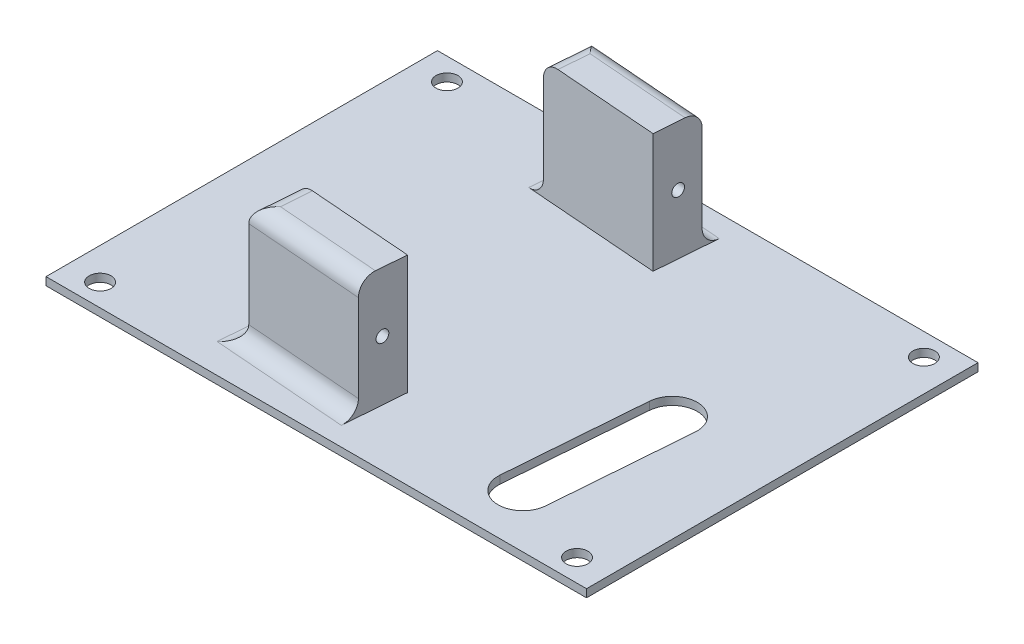
from build123d import *

# Parameters (mm, degrees)
IZIM1_W                     = 54.4
IZIM1_H                     = 39.4
Y_KSEKLIK_EKSTR_ZYON1_DEPTH = 0.8
IZIM2_R                     = 1.1
KES_EKSTR_ZYON1_DEPTH       = 68.174102153
Y_KSEKLIK_EKSTR_ZYON2_DEPTH = 12
KES_EKSTR_ZYON2_DEPTH       = 69.23283667
IZIM4_R                     = 0.6
KES_EKSTR_ZYON3_DEPTH       = 6
RADYUS1_R                   = 1.6


with BuildPart() as part:
    # Çizim1 → Yükseklik-Ekstrüzyon1 (new body)
    with BuildSketch(Plane(origin=(0, 0, 0), x_dir=(1, 0, 0), z_dir=(0, 1, 0))):
        with Locations((27.2, 19.7)):
            Rectangle(IZIM1_W, IZIM1_H)
    extrude(amount=Y_KSEKLIK_EKSTR_ZYON1_DEPTH)

    # Çizim2 → Kes-Ekstrüzyon1 (cut, through all)
    with BuildSketch(Plane(origin=(0, 0.8, 0), x_dir=(1, 0, 0), z_dir=(0, 1, 0))):
        with Locations((3.2, 37.155)):
            Circle(IZIM2_R)
        with Locations((51.2, 37.155)):
            Circle(IZIM2_R)
        with Locations((3.2, 2.245)):
            Circle(IZIM2_R)
        with Locations((51.2, 2.245)):
            Circle(IZIM2_R)
    extrude(amount=-KES_EKSTR_ZYON1_DEPTH, mode=Mode.SUBTRACT)

    # Çizim3 → Yükseklik-Ekstrüzyon2 (add)
    with BuildSketch(Plane(origin=(0, 0.8, 0), x_dir=(1, 0, 0), z_dir=(0, 1, 0))):
        Polygon((16.339737047, 9.008662918), (15.983627663, 4.422467752), (27.947615054, 3.49348675), (28.303724438, 8.079681916), align=None)
        Polygon((30.440380743, 35.596852916), (18.476393352, 36.525833918), (18.120283968, 31.939638752), (30.084271359, 31.01065775), align=None)
    extrude(amount=Y_KSEKLIK_EKSTR_ZYON2_DEPTH)

    # Çizim3<3> → Kes-Ekstrüzyon2 (cut, through all)
    with BuildSketch(Plane(origin=(0, 0.8, 0), x_dir=(1, 0, 0), z_dir=(0, 1, 0))):
        with BuildLine():
            Line((45.128842442, 5.168427178), (46.212653611, 19.126412468))
            ThreePointArc((46.212653611, 19.126412468), (43.913693947, 21.81244755), (41.227658865, 19.513487885))
            Line((41.227658865, 19.513487885), (40.143847696, 5.555502595))
            ThreePointArc((40.143847696, 5.555502595), (42.44280736, 2.869467514), (45.128842442, 5.168427178))
        make_face()
    extrude(amount=-KES_EKSTR_ZYON2_DEPTH, mode=Mode.SUBTRACT)

    # Çizim4 → Kes-Ekstrüzyon3 (cut)
    with BuildSketch(Plane(origin=(27.510485399, 0, 2.136137181), x_dir=(0.07741508350800423, 0, -0.9969989492699823), z_dir=(0.9969989492699823, 0, 0.07741508350800423))):
        with Locations((7.896569572, 6.8)):
            Circle(IZIM4_R)
        with Locations((35.596569572, 6.8)):
            Circle(IZIM4_R)
    extrude(amount=-KES_EKSTR_ZYON3_DEPTH, mode=Mode.SUBTRACT)

    # Radyus1
    radyus1_edges = [part.edges().sort_by_distance(p)[0] for p in [
        (16.161682355, 12.8, -6.715565335),
        (21.965621358, 12.8, -3.957977251),
        (24.458387047, 12.8, -36.061343417),
        (18.29833866, 12.8, -34.232736335),
        (24.458387047, 0.8, -36.061343417),
        (18.29833866, 0.8, -34.232736335),
        (16.161682355, 0.8, -6.715565335),
        (21.965621358, 0.8, -3.957977251),
    ]]
    fillet(radyus1_edges, radius=RADYUS1_R)


solid = part.part
